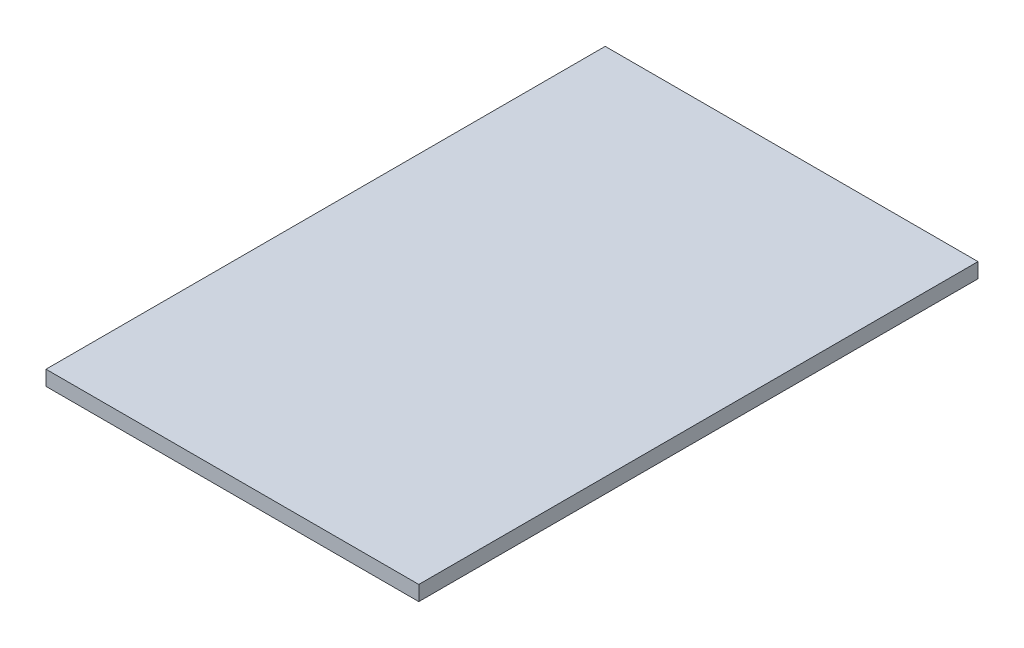
from build123d import *

# Parameters (mm, degrees)
SKETCH2_W           = 100
SKETCH2_H           = 150
BOSS_EXTRUDE1_DEPTH = 4


with BuildPart() as part:
    # Sketch2 → Boss-Extrude1 (new body)
    with BuildSketch(Plane(origin=(0, 0, 0), x_dir=(1, 0, 0), z_dir=(0, 1, 0))):
        with Locations((50, -75)):
            Rectangle(SKETCH2_W, SKETCH2_H)
    extrude(amount=BOSS_EXTRUDE1_DEPTH)


solid = part.part
